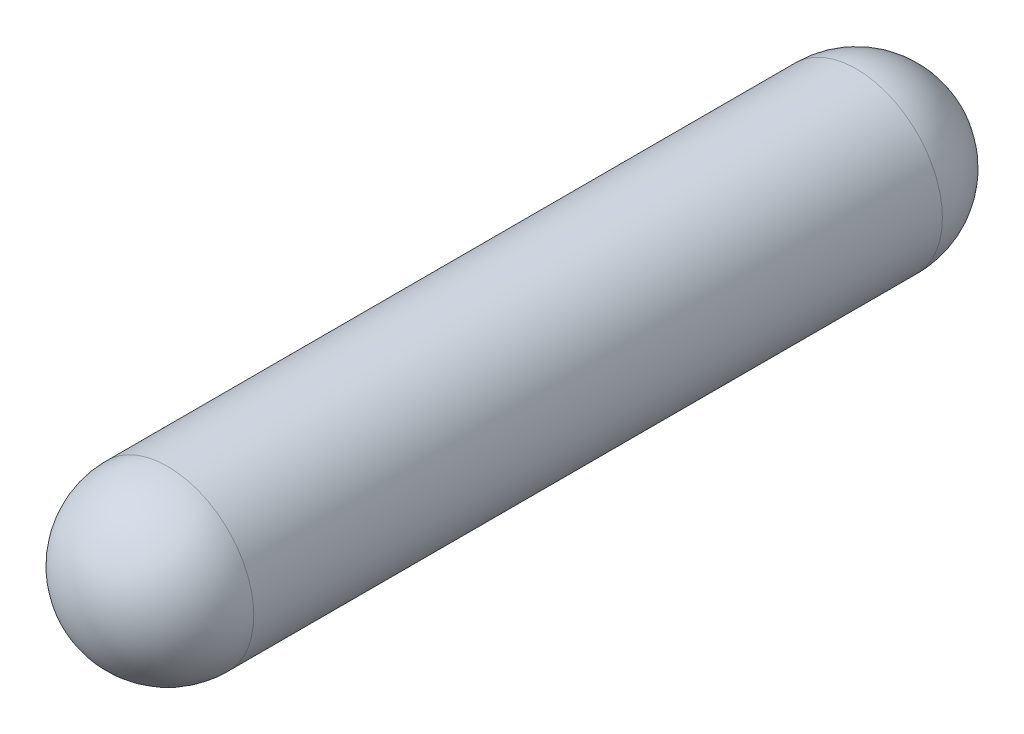
from build123d import *


with BuildPart() as part:
    # Sketch10 → Revolve2 (revolve)
    with BuildSketch(Plane(origin=(0, 0, 0), x_dir=(1, 0, 0), z_dir=(0, 1, 0))):
        with BuildLine():
            Line((0, 0), (0, 10000))
            ThreePointArc((0, 10000), (707.106781187, 9707.106781187), (1000, 9000))
            Line((1000, 9000), (1000, 1000))
            ThreePointArc((1000, 1000), (707.106781187, 292.893218813), (0, 0))
        make_face()
    revolve(axis=Axis((0, 0, 0), (0, 0, -1)))


solid = part.part
